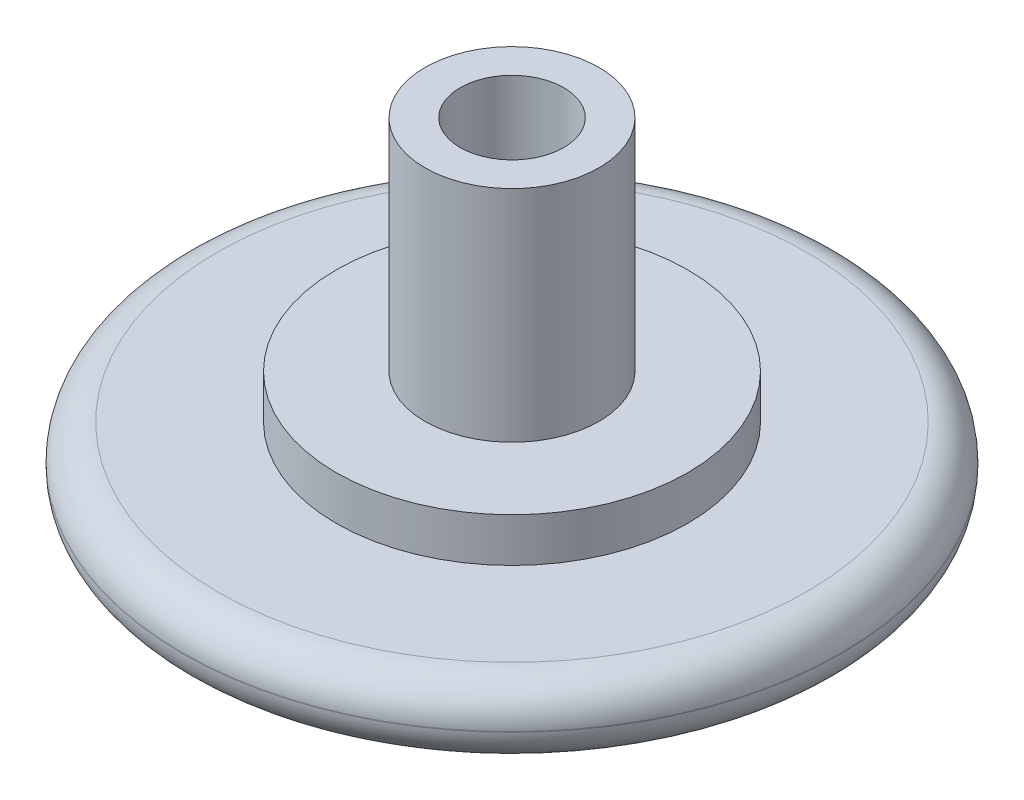
from build123d import *

# Parameters (mm, degrees)
CROQUIS1_R              = 7.5
SALIENTE_EXTRUIR1_DEPTH = 2
CROQUIS2_R              = 4
SALIENTE_EXTRUIR2_DEPTH = 1
CROQUIS3_R              = 1.98
CROQUIS3_R_2            = 1.18
HEMBRA_DEPTH            = 5
REDONDEO1_R             = 0.8


with BuildPart() as part:
    # Croquis1 → Saliente-Extruir1 (new body)
    with BuildSketch(Plane(origin=(0, 0, 0), x_dir=(1, 0, 0), z_dir=(0, 1, 0))):
        with Locations(Location((0, 0, 0), (0, 0, 270))):
            Circle(CROQUIS1_R)
    extrude(amount=SALIENTE_EXTRUIR1_DEPTH)

    # Croquis2 → Saliente-Extruir2 (add)
    with BuildSketch(Plane(origin=(0, 2, 0), x_dir=(1, 0, 0), z_dir=(0, 1, 0))):
        with Locations(Location((0, 0, 0), (0, 0, 270))):
            Circle(CROQUIS2_R)
    extrude(amount=SALIENTE_EXTRUIR2_DEPTH)

    # Croquis3 → Hembra (add)
    with BuildSketch(Plane(origin=(0, 3, 0), x_dir=(1, 0, 0), z_dir=(0, 1, 0))):
        with Locations(Location((0, 0, 0), (0, 0, 270))):
            Circle(CROQUIS3_R)
        with Locations(Location((0, 0, 0), (0, 0, 270))):
            Circle(CROQUIS3_R_2, mode=Mode.SUBTRACT)
    extrude(amount=HEMBRA_DEPTH)

    # Croquis4 → Cortar-Revolución1 (revolve, cut)
    with BuildSketch(Plane.XY, mode=Mode.PRIVATE) as cortar_revoluci_n1_sk:
        with BuildLine():
            Line((0, 1), (0, 0))
            Line((0, 0), (7.5, 0))
            ThreePointArc((7.5, 0), (5.304886114, 0.746987514), (3, 1))
            Line((3, 1), (0, 1))
        make_face()
    revolve(cortar_revoluci_n1_sk.sketch.rotate(Axis((0, 6.93, 0), (0, -1, 0)), 90), axis=Axis((0, 6.93, 0), (0, -1, 0)), mode=Mode.SUBTRACT)

    # Redondeo1
    redondeo1_edges = [part.edges().sort_by_distance(p)[0] for p in [
        (0, 0, -7.5),
        (0, 2, -7.5),
    ]]
    fillet(redondeo1_edges, radius=REDONDEO1_R)


solid = part.part
